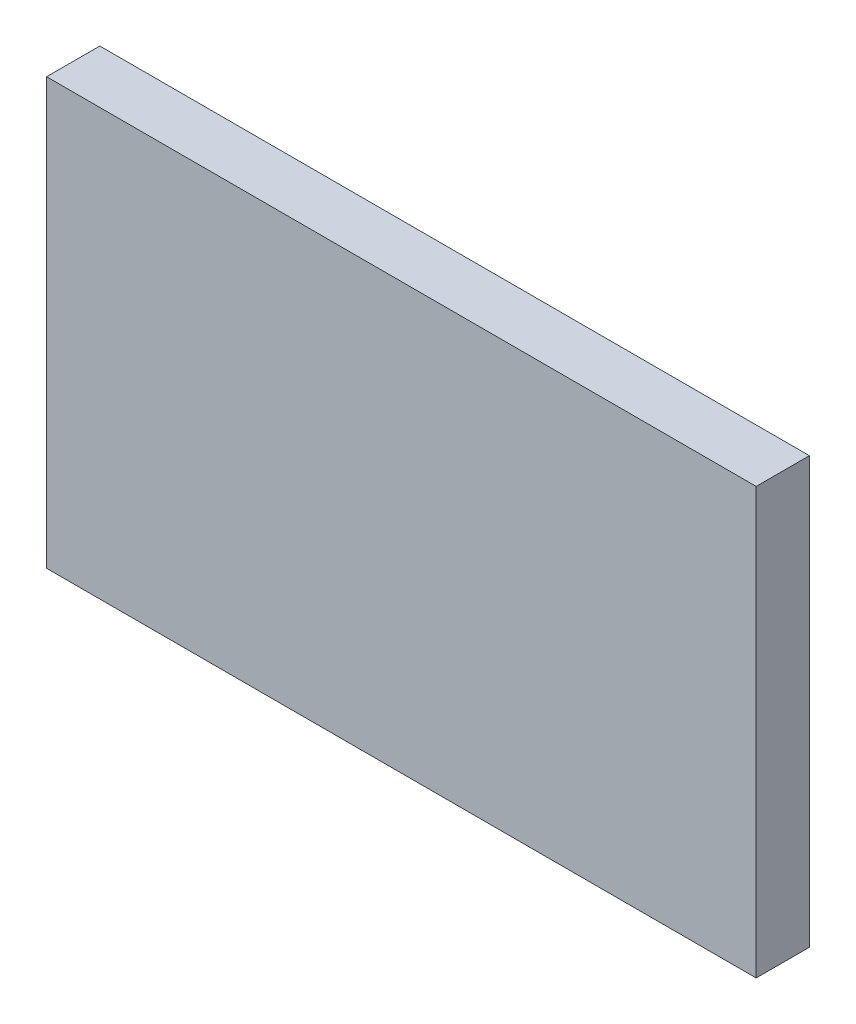
from build123d import *

# Parameters (mm, degrees)
SKETCH1_W  = 127
SKETCH1_H  = 76.2
BASE_DEPTH = 9.525


with BuildPart() as part:
    # Sketch1 → base (new body)
    with BuildSketch(Plane.XY):
        with Locations((63.5, 38.1)):
            Rectangle(SKETCH1_W, SKETCH1_H)
    extrude(amount=BASE_DEPTH)


solid = part.part
